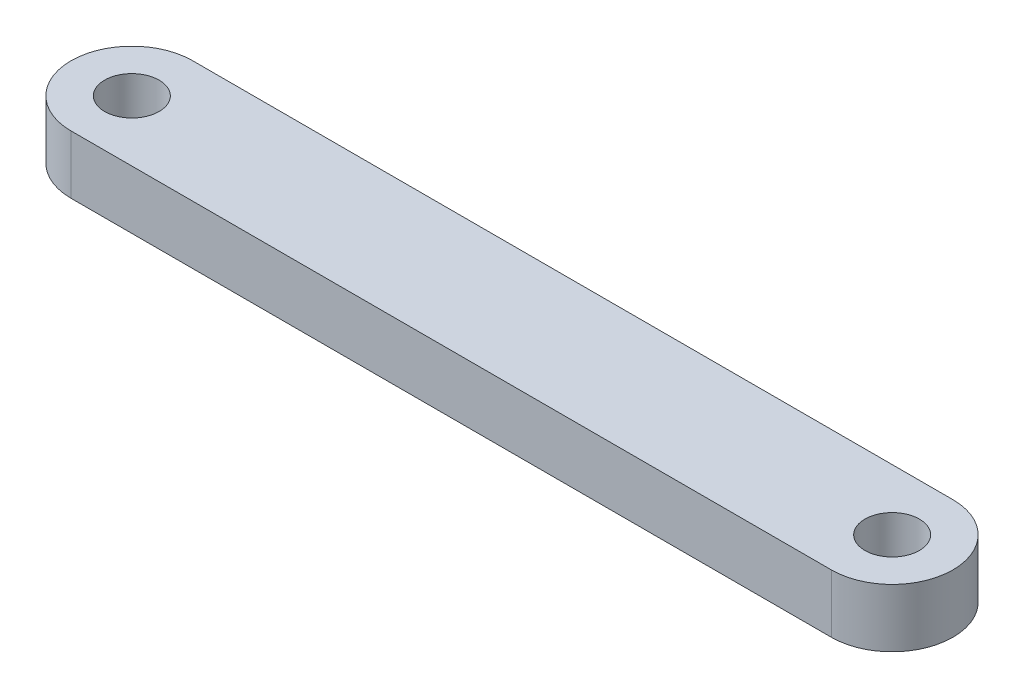
from build123d import *

# Parameters (mm, degrees)
SKETCH1_R           = 1.4224
BOSS_EXTRUDE1_DEPTH = 3.048


with BuildPart() as part:
    # Sketch1 → Boss-Extrude1 (new body)
    with BuildSketch(Plane(origin=(0, 0, 0), x_dir=(1, 0, 0), z_dir=(0, 1, 0))):
        with BuildLine():
            Line((-19.8501, 3.175), (19.8501, 3.175))
            ThreePointArc((19.8501, 3.175), (23.0251, 0), (19.8501, -3.175))
            Line((19.8501, -3.175), (-19.8501, -3.175))
            ThreePointArc((-19.8501, -3.175), (-23.0251, 0), (-19.8501, 3.175))
        make_face()
        with Locations(Location((-19.8501, 0, 0), (0, 0, 90))):
            Circle(SKETCH1_R, mode=Mode.SUBTRACT)
        with Locations(Location((19.8501, 0, 0), (0, 0, 90))):
            Circle(SKETCH1_R, mode=Mode.SUBTRACT)
    extrude(amount=BOSS_EXTRUDE1_DEPTH)


solid = part.part
